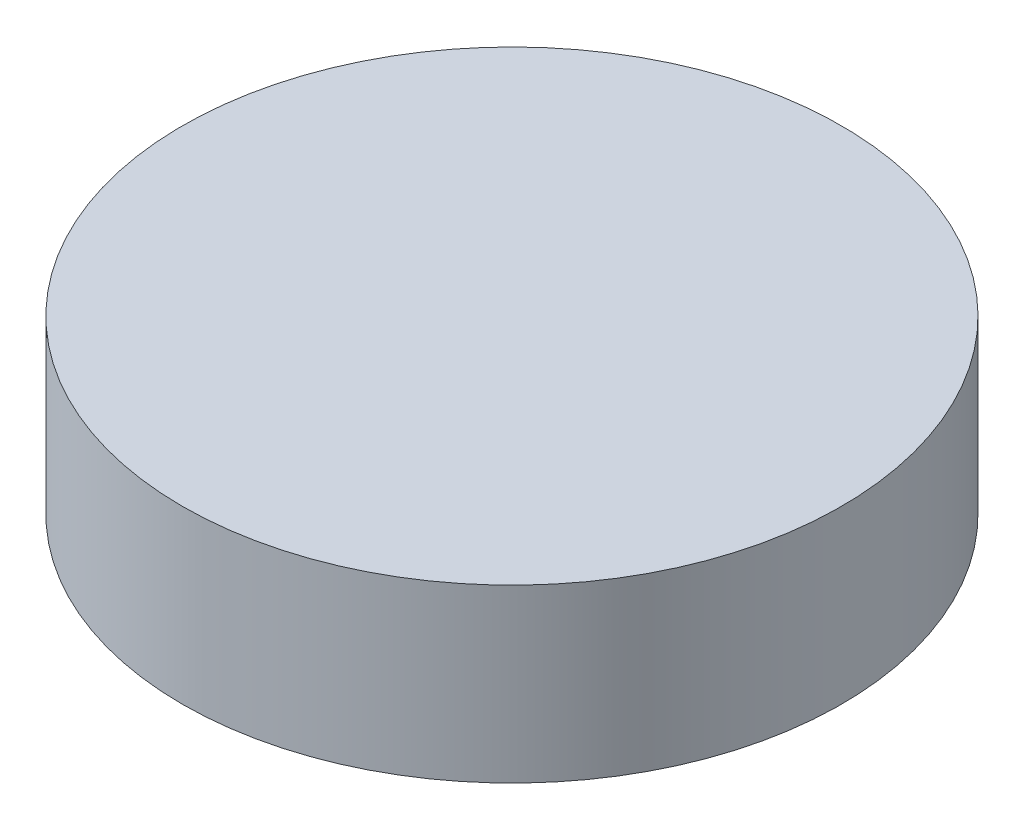
from build123d import *

# Parameters (mm, degrees)
SKETCH1_R           = 48.833336451
BOSS_EXTRUDE1_DEPTH = 25.4


with BuildPart() as part:
    # Sketch1 → Boss-Extrude1 (new body)
    with BuildSketch(Plane(origin=(0, 0, 0), x_dir=(1, 0, 0), z_dir=(0, 1, 0))):
        with Locations(Location((0, -2.076207636, 0), (0, 0, 270))):
            Circle(SKETCH1_R)
    extrude(amount=BOSS_EXTRUDE1_DEPTH)


solid = part.part
